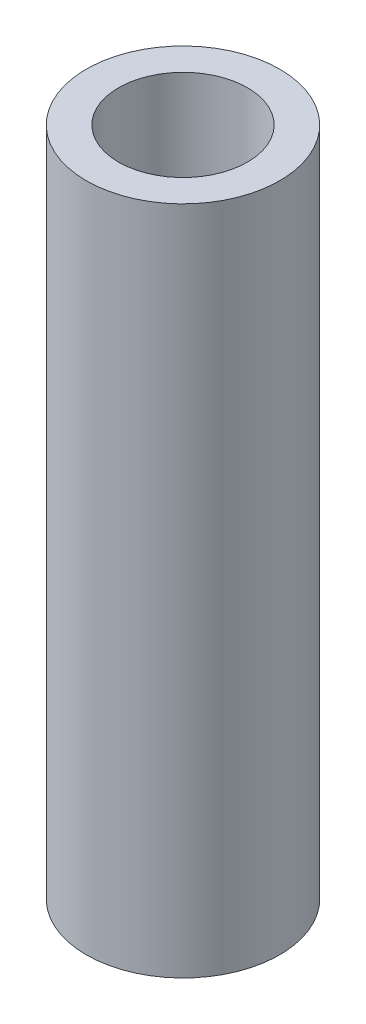
from build123d import *

# Parameters (mm, degrees)
SKETCH1_R           = 4.7625
SKETCH1_R_2         = 3.175
BOSS_EXTRUDE1_DEPTH = 33.02


with BuildPart() as part:
    # Sketch1 → Boss-Extrude1 (new body)
    with BuildSketch(Plane(origin=(0, 0, 0), x_dir=(1, 0, 0), z_dir=(0, 1, 0))):
        with Locations(Location((0, 0, 0), (0, 0, 270))):
            Circle(SKETCH1_R)
        with Locations(Location((0, 0, 0), (0, 0, 270))):
            Circle(SKETCH1_R_2, mode=Mode.SUBTRACT)
    extrude(amount=-BOSS_EXTRUDE1_DEPTH)


solid = part.part
